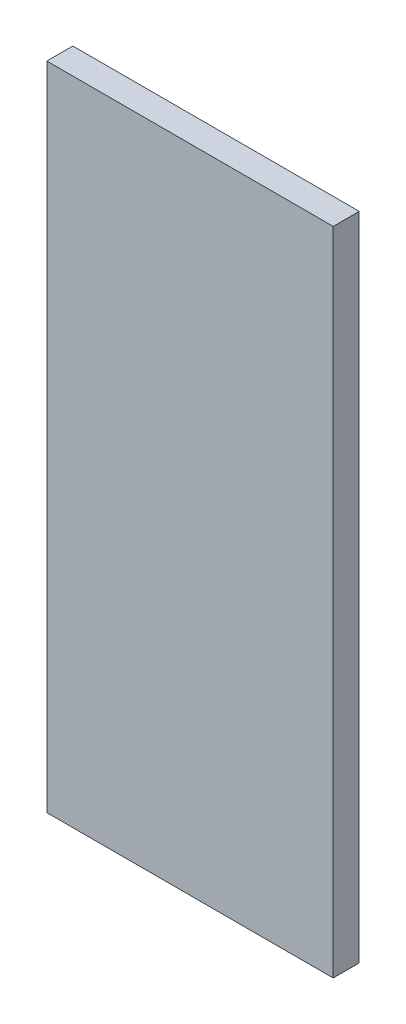
from build123d import *

# Parameters (mm, degrees)
SKETCH1_W           = 22
SKETCH1_H           = 50
BOSS_EXTRUDE1_DEPTH = 2


with BuildPart() as part:
    # Sketch1 → Boss-Extrude1 (new body)
    with BuildSketch(Plane.XY):
        with Locations((1.825986963, 4.878159859)):
            Rectangle(SKETCH1_W, SKETCH1_H)
    extrude(amount=BOSS_EXTRUDE1_DEPTH)


solid = part.part
